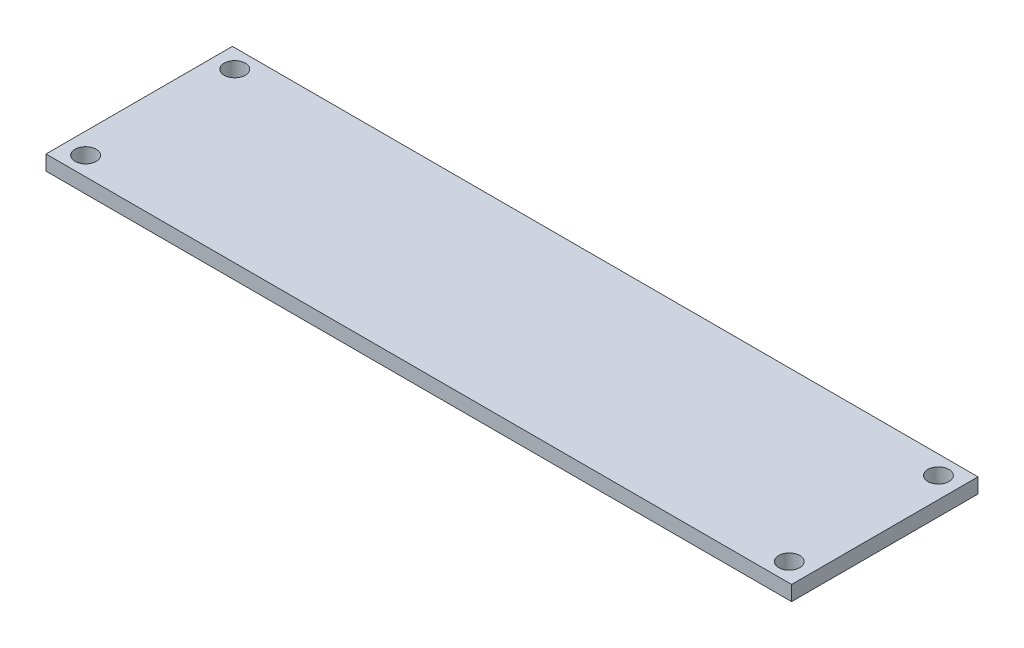
from build123d import *

# Parameters (mm, degrees)
SKETCH_1_W      = 80
SKETCH_1_H      = 20
SKETCH_1_R      = 1.133021485
EXTRUDE_1_DEPTH = 1.6


with BuildPart() as part:
    # 草图1 → 凸台-拉伸1 (new body)
    with BuildSketch(Plane(origin=(0, 0, 0), x_dir=(1, 0, 0), z_dir=(0, 1, 0))):
        with Locations((40, 10)):
            Rectangle(SKETCH_1_W, SKETCH_1_H)
        with Locations(Location((2.25, 18, 0), (0, 0, 270))):
            Circle(SKETCH_1_R, mode=Mode.SUBTRACT)
        with Locations(Location((77.75, 18, 0), (0, 0, 90))):
            Circle(SKETCH_1_R, mode=Mode.SUBTRACT)
        with Locations(Location((77.75, 2, 0), (0, 0, 270))):
            Circle(SKETCH_1_R, mode=Mode.SUBTRACT)
        with Locations(Location((2.25, 2, 0), (0, 0, 90))):
            Circle(SKETCH_1_R, mode=Mode.SUBTRACT)
    extrude(amount=EXTRUDE_1_DEPTH)


solid = part.part
